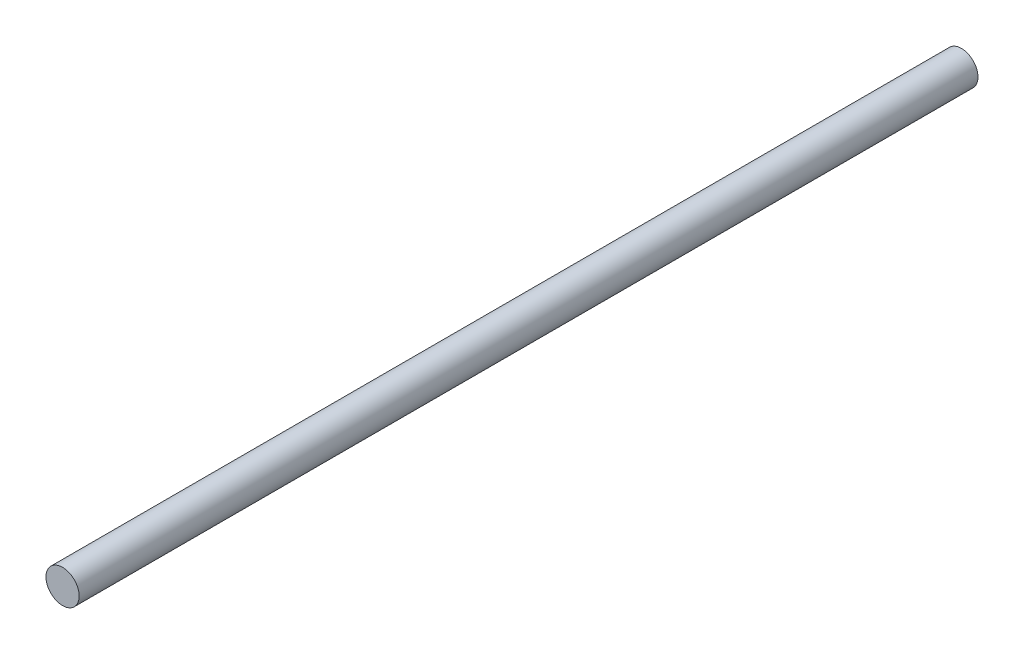
from build123d import *

# Parameters (mm, degrees)
SKETCH1_R           = 5.99948
BOSS_EXTRUDE1_DEPTH = 325.00062


with BuildPart() as part:
    # Sketch1 → Boss-Extrude1 (new body)
    with BuildSketch(Plane.XY):
        Circle(SKETCH1_R)
    extrude(amount=BOSS_EXTRUDE1_DEPTH)


solid = part.part
